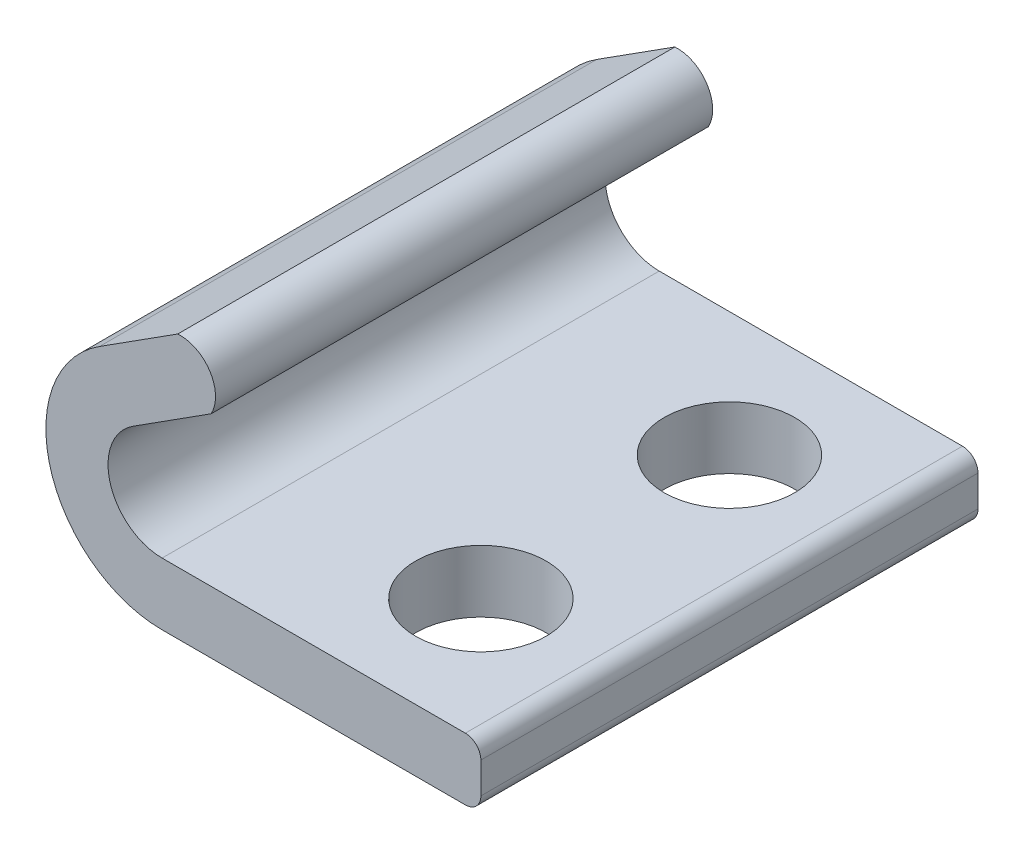
from build123d import *

# Parameters (mm, degrees)
EXTRUDE_1_DEPTH         = 16
HOLE_WIZARD_4_2_4_2_1_D = 4.2
FILLET_1_R              = 0.5


with BuildPart() as part:
    # Эскиз1 → Бобышка-Вытянуть1 (new body)
    with BuildSketch(Plane.XY.offset(8)):
        with BuildLine():
            Line((-9.756337345, 8.497441256), (-12.271369771, 6.893092394))
            ThreePointArc((-12.271369771, 6.893092394), (-13.850276142, 2.692375438), (-10.26, 0))
            Line((-10.26, 0), (0, 0))
            Line((0, 0), (0, 2))
            Line((0, 2), (-10.26, 2))
            ThreePointArc((-10.26, 2), (-11.930342376, 3.252602477), (-11.195770963, 5.206946729))
            Line((-11.195770963, 5.206946729), (-8.680738537, 6.81129559))
            ThreePointArc((-8.680738537, 6.81129559), (-8.718896971, 7.97309132), (-9.756337345, 8.497441256))
        make_face()
    extrude(amount=-EXTRUDE_1_DEPTH)

    # Диаметр отверстия Ø4.2 (4.2)1 (through all)
    with Locations(Plane(origin=(0, 2, 0), x_dir=(1, 0, 0), z_dir=(0, 1, 0))):
        with Locations((-4, 4), (-4, -4)):
            Hole(HOLE_WIZARD_4_2_4_2_1_D / 2)

    # Скругление1
    fillet_1_edges = [part.edges().sort_by_distance(p)[0] for p in [
        (0, 2, 0),
        (0, 0, 0),
    ]]
    fillet(fillet_1_edges, radius=FILLET_1_R)


solid = part.part
